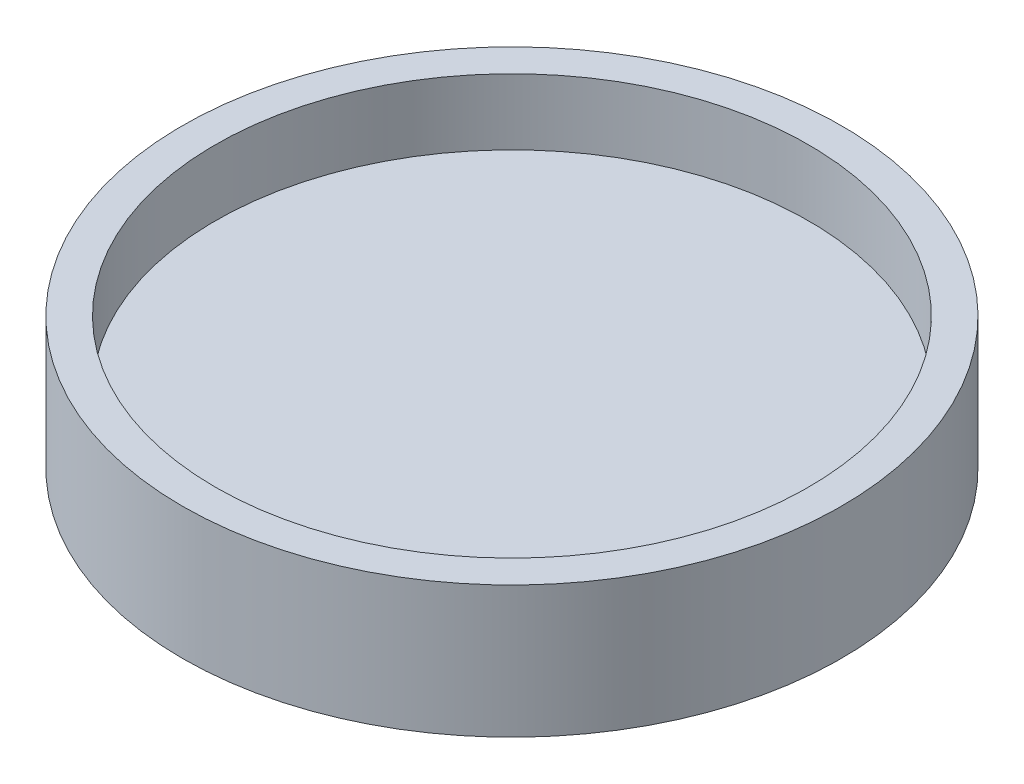
from build123d import *

# Parameters (mm, degrees)
SKETCH_1_R          = 25
EXTRUDE_1_DEPTH     = 10
SKETCH_3_R          = 22.5
CUT_EXTRUDE_1_DEPTH = 5


with BuildPart() as part:
    # 草圖1 → 填料-伸長1 (new body)
    with BuildSketch(Plane(origin=(0, 0, 0), x_dir=(1, 0, 0), z_dir=(0, 1, 0))):
        with Locations(Location((0, 0, 0), (0, 0, 270))):
            Circle(SKETCH_1_R)
    extrude(amount=EXTRUDE_1_DEPTH)

    # 草圖3 → 除料-伸長1 (cut)
    with BuildSketch(Plane(origin=(0, 10, 0), x_dir=(1, 0, 0), z_dir=(0, 1, 0))):
        with Locations(Location((0, 0, 0), (0, 0, 270))):
            Circle(SKETCH_3_R)
    extrude(amount=-CUT_EXTRUDE_1_DEPTH, mode=Mode.SUBTRACT)


solid = part.part
